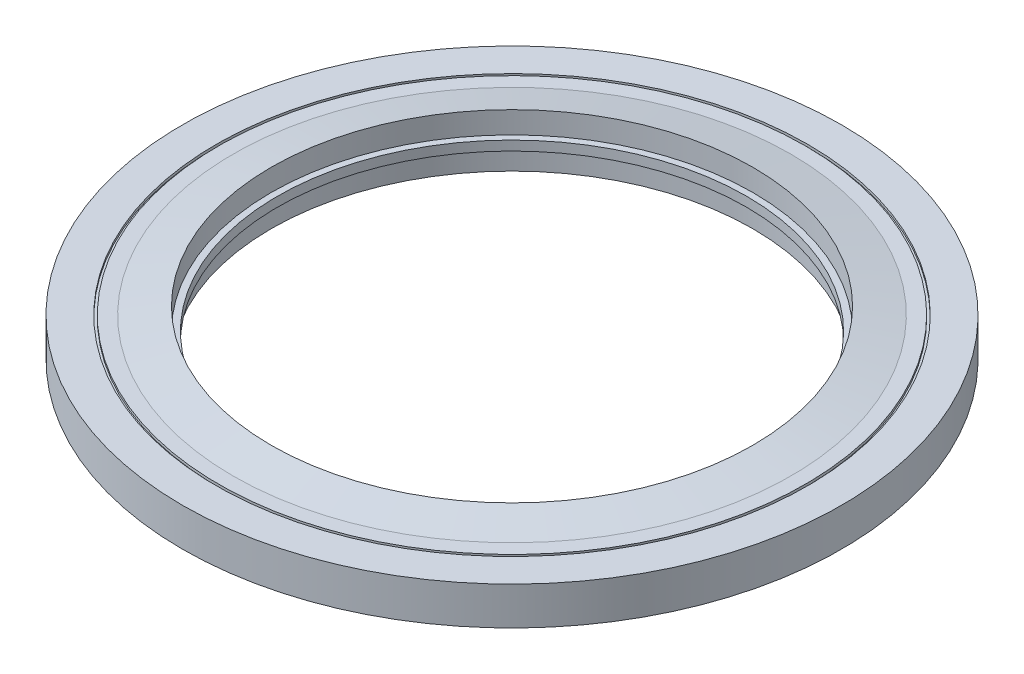
from build123d import *


with BuildPart() as part:
    # Sketch1 → Revolve1 (revolve)
    with BuildSketch(Plane.XY, mode=Mode.PRIVATE) as revolve1_sk:
        Polygon((9.25, -0.1875), (9.25, 0.1875), (9.5, 0.1875), (9.5, 1.05), (11, 0.75), (11.566666667, 0.75), (11.566666667, 0.65), (11.666666667, 0.65), (11.666666667, 0.75), (13, 0.75), (13, -0.75), (11.666666667, -0.75), (11.666666667, -0.65), (11.566666667, -0.65), (11.566666667, -0.75), (11, -0.75), (9.5, -1.05), (9.5, -0.1875), align=None)
    revolve(revolve1_sk.sketch.rotate(Axis((0, 0, 0), (0, 1, 0)), 90), axis=Axis((0, 0, 0), (0, 1, 0)))


solid = part.part
